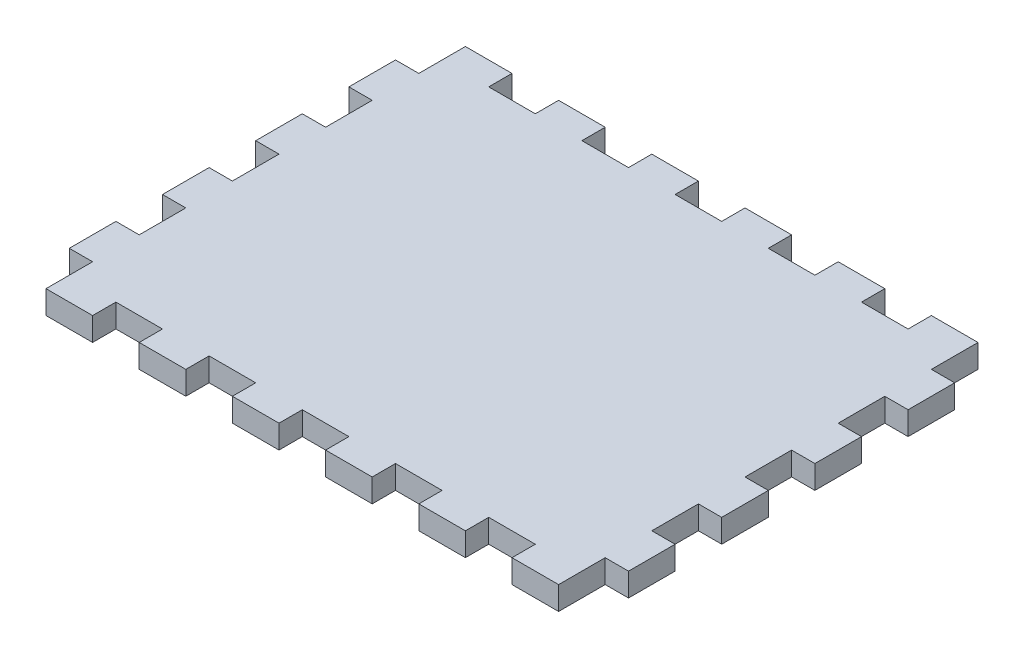
from build123d import *

# Parameters (mm, degrees)
BOSS_EXTRUDE1_DEPTH = 2.5


with BuildPart() as part:
    # Sketch1 → Boss-Extrude1 (new, symmetric)
    with BuildSketch(Plane(origin=(0, 0, 0), x_dir=(1, 0, 0), z_dir=(0, 1, 0))):
        Polygon((55, 45), (45, 45), (45, 40), (35, 40), (35, 45), (25, 45), (25, 40), (15, 40), (15, 45), (5, 45), (5, 40), (-5, 40), (-5, 45), (-15, 45), (-15, 40), (-25, 40), (-25, 45), (-35, 45), (-35, 40), (-45, 40), (-45, 45), (-55, 45), (-55, 40), (-55, 35), (-60, 35), (-60, 25), (-55, 25), (-55, 15), (-60, 15), (-60, 5), (-55, 5), (-55, -5), (-60, -5), (-60, -15), (-55, -15), (-55, -25), (-60, -25), (-60, -35), (-55, -35), (-55, -40), (-55, -45), (-45, -45), (-45, -40), (-35, -40), (-35, -45), (-25, -45), (-25, -40), (-15, -40), (-15, -45), (-5, -45), (-5, -40), (5, -40), (5, -45), (15, -45), (15, -40), (25, -40), (25, -45), (35, -45), (35, -40), (45, -40), (45, -45), (55, -45), (55, -40), (55, -35), (60, -35), (60, -25), (55, -25), (55, -15), (60, -15), (60, -5), (55, -5), (55, 5), (60, 5), (60, 15), (55, 15), (55, 25), (60, 25), (60, 35), (55, 35), (55, 40), align=None)
    extrude(amount=BOSS_EXTRUDE1_DEPTH, both=True)


solid = part.part
